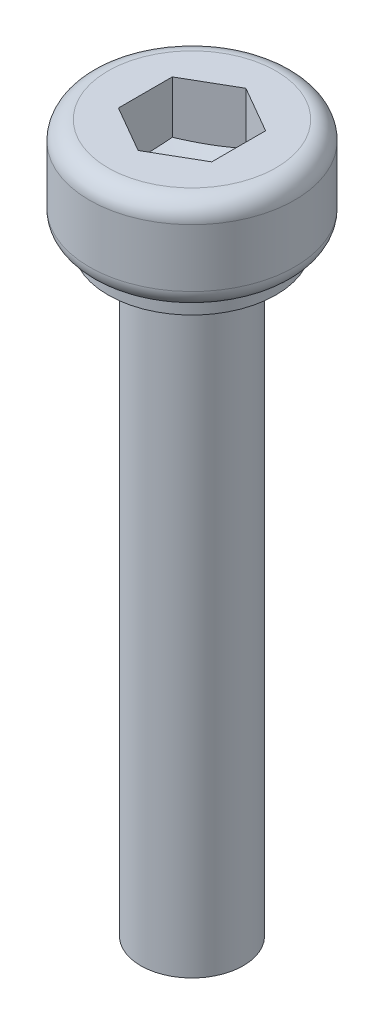
from build123d import *

# Parameters (mm, degrees)
BOSS_EXTRUDE1_DEPTH = 2


with BuildPart() as part:
    # Sketch1 → Revolve1 (revolve)
    with BuildSketch(Plane.XY):
        with BuildLine():
            Line((0, 9.475), (2.25, 9.475))
            ThreePointArc((2.25, 9.475), (2.603553391, 9.328553391), (2.75, 8.975))
            Line((2.75, 8.975), (2.75, 7.425))
            ThreePointArc((2.75, 7.425), (2.603553391, 7.071446609), (2.25, 6.925))
            Line((2.25, 6.925), (2.25, 6.525))
            Line((2.25, 6.525), (1.375, 6.525))
            Line((1.375, 6.525), (1.375, -9.475))
            Line((1.375, -9.475), (0, -9.475))
            Line((0, -9.475), (0, 9.475))
        make_face()
    revolve(axis=Axis((0, 4.094224924, 0), (0, -1, 0)))


with BuildPart() as body_2:
    # Sketch2 → Boss-Extrude1 (new body)
    with BuildSketch(Plane(origin=(0, 9.475, 0), x_dir=(1, 0, 0), z_dir=(0, 1, 0))):
        Polygon((0, 1.443375673), (-1.25, 0.721687836), (-1.25, -0.721687836), (0, -1.443375673), (1.25, -0.721687836), (1.25, 0.721687836), align=None)
    extrude(amount=-BOSS_EXTRUDE1_DEPTH)

    # Sketch3 → Cut-Revolve1 (revolve, cut)
    with BuildSketch(Plane(origin=(0, 0, 0), x_dir=(0, 0, -1), z_dir=(1, 0, 0))):
        Polygon((0, 7.875), (0.4, 7.875), (1.443375673, 8.075), (1.443375673, 7.475), (0, 7.475), align=None)
    revolve(axis=Axis((0, 7.475, 0), (0, 1, 0)), mode=Mode.SUBTRACT)


with BuildPart() as part_1:
    add(part.part)

    # Combine1: cut body 2
    add(body_2.part, mode=Mode.SUBTRACT)


solid = part_1.part
